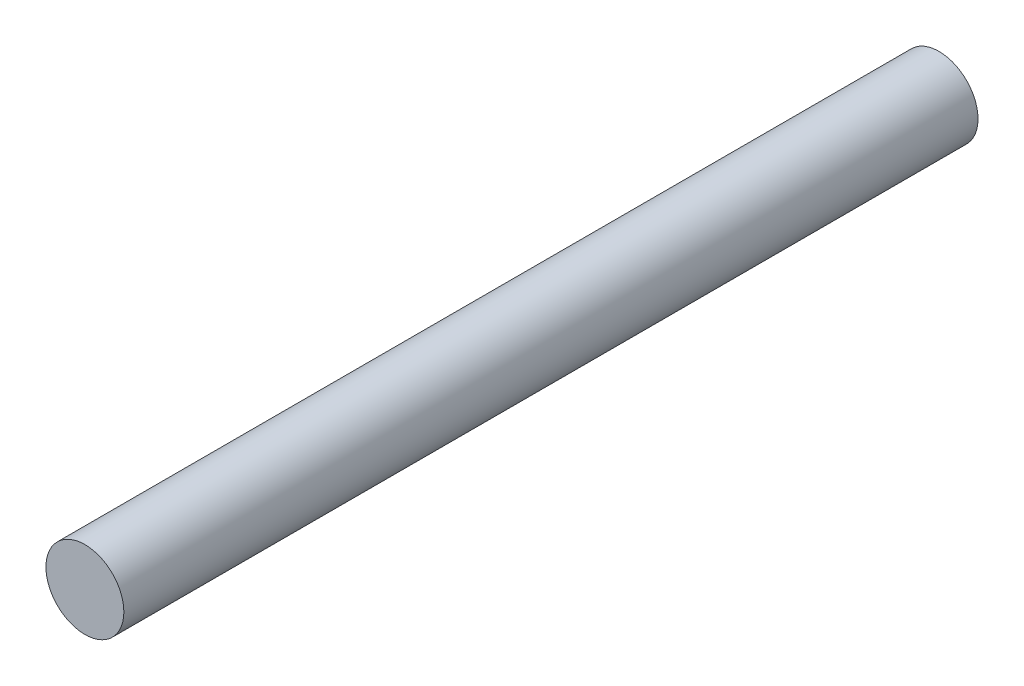
from build123d import *

# Parameters (mm, degrees)
SKETCH1_R           = 6.35
BOSS_EXTRUDE1_DEPTH = 139.192


with BuildPart() as part:
    # Sketch1 → Boss-Extrude1 (new body)
    with BuildSketch(Plane.XY):
        Circle(SKETCH1_R)
    extrude(amount=-BOSS_EXTRUDE1_DEPTH)


solid = part.part
